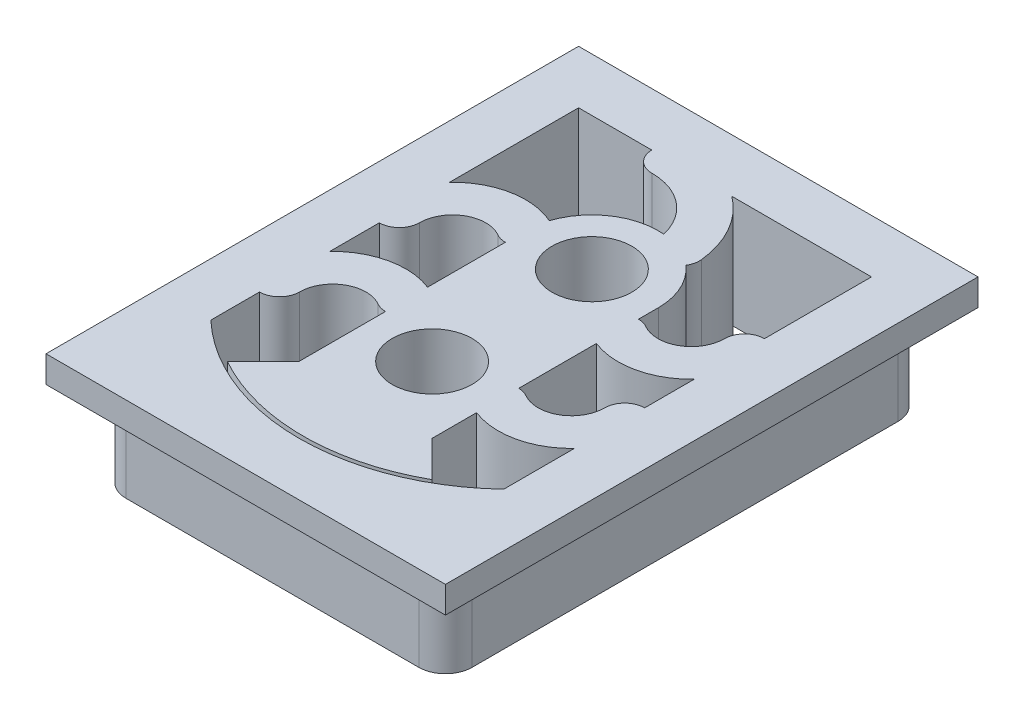
from build123d import *

# Parameters (mm, degrees)
SKETCH1_W           = 13
SKETCH1_H           = 18
BOSS_EXTRUDE1_DEPTH = 3.2
SKETCH2_W           = 15
SKETCH2_H           = 20
BOSS_EXTRUDE2_DEPTH = 1
SKETCH4_R           = 1.5
CUT_EXTRUDE2_DEPTH  = 14.18673576
FILLET1_R           = 1


with BuildPart() as part:
    # Sketch1 → Boss-Extrude1 (new body)
    with BuildSketch(Plane(origin=(0, 0, 0), x_dir=(1, 0, 0), z_dir=(0, 1, 0))):
        Rectangle(SKETCH1_W, SKETCH1_H)
    extrude(amount=BOSS_EXTRUDE1_DEPTH)

    # Sketch2 → Boss-Extrude2 (add)
    with BuildSketch(Plane(origin=(0, 3.2, 0), x_dir=(1, 0, 0), z_dir=(0, 1, 0))):
        Rectangle(SKETCH2_W, SKETCH2_H)
    extrude(amount=BOSS_EXTRUDE2_DEPTH)

    # Sketch4 → Cut-Extrude2 (cut, through all)
    with BuildSketch(Plane.XZ):
        with BuildLine():
            Line((-2.5, 5.5), (-3.844272635, 6.844272635))
            ThreePointArc((-3.844272635, 6.844272635), (0, 7.85), (3.844272635, 6.844272635))
            Line((3.844272635, 6.844272635), (2.5, 5.5))
            Line((2.5, 5.5), (2.5, 2.25))
            ThreePointArc((2.5, 2.25), (2.694114284, 2.22444437), (2.875, 2.149519053))
            ThreePointArc((2.875, 2.149519053), (4.125, 2.149519053), (4.75, 3.232050808))
            ThreePointArc((4.75, 3.232050808), (4.969669914, 3.762380893), (5.5, 3.982050808))
            Line((5.5, 3.982050808), (5.5, 5.809475019))
            ThreePointArc((5.5, 5.809475019), (0, 8), (-5.5, 5.809475019))
            Line((-5.5, 5.809475019), (-5.5, 3.155407801))
            ThreePointArc((-5.5, 3.155407801), (-4.103044833, 3.951014031), (-2.5, 3.829686884))
            Line((-2.5, 3.829686884), (-2.5, 5.5))
        make_face()
        with Locations(Location((0, 3, 0), (0, 0, 270))):
            Circle(SKETCH4_R)
        with BuildLine():
            Line((-2.5, -0.670313116), (-2.5, 2.25))
            ThreePointArc((-2.5, 2.25), (-2.694114284, 2.27555563), (-2.875, 2.350480947))
            ThreePointArc((-2.875, 2.350480947), (-4.125, 2.350480947), (-4.75, 1.267949192))
            ThreePointArc((-4.75, 1.267949192), (-4.969669914, 0.737619107), (-5.5, 0.517949192))
            Line((-5.5, 0.517949192), (-5.5, -1.344592199))
            ThreePointArc((-5.5, -1.344592199), (-4.103044833, -0.548985969), (-2.5, -0.670313116))
        make_face()
        with BuildLine():
            ThreePointArc((5.5, 1.344592199), (4.103044833, 0.548985969), (2.5, 0.670313116))
            Line((2.5, 0.670313116), (2.5, -2.25))
            ThreePointArc((2.5, -2.25), (2.694114284, -2.27555563), (2.875, -2.350480947))
            ThreePointArc((2.875, -2.350480947), (4.125, -2.350480947), (4.75, -1.267949192))
            ThreePointArc((4.75, -1.267949192), (4.969669914, -0.737619107), (5.5, -0.517949192))
            Line((5.5, -0.517949192), (5.5, 1.344592199))
        make_face()
        with Locations(Location((0, -3, 0), (0, 0, 270))):
            Circle(SKETCH4_R)
        with BuildLine():
            Line((-2.5, -3), (-2.5, -2.25))
            ThreePointArc((-2.5, -2.25), (-2.694114284, -2.22444437), (-2.875, -2.149519053))
            ThreePointArc((-2.875, -2.149519053), (-4.125, -2.149519053), (-4.75, -3.232050808))
            ThreePointArc((-4.75, -3.232050808), (-4.969669914, -3.762380893), (-5.5, -3.982050808))
            Line((-5.5, -3.982050808), (-5.5, -8))
            Line((-5.5, -8), (-0.25521468, -8))
            ThreePointArc((-0.25521468, -8), (-1.276630283, -6.840114098), (-1.746104794, -5.367626807))
            ThreePointArc((-1.746104794, -5.367626807), (-1.730239257, -5.120259699), (-1.634609263, -4.891574095))
            ThreePointArc((-1.634609263, -4.891574095), (-2.27338109, -4.040066547), (-2.5, -3))
        make_face()
        with BuildLine():
            ThreePointArc((5.5, -3.155407801), (4.037255458, -3.964958012), (2.375948891, -3.777731873))
            ThreePointArc((2.375948891, -3.777731873), (1.381615815, -5.083539714), (-0.208211888, -5.491314474))
            ThreePointArc((-0.208211888, -5.491314474), (0.58851368, -6.756605145), (2, -7.25))
            ThreePointArc((2, -7.25), (2.530330086, -7.469669914), (2.75, -8))
            Line((2.75, -8), (5.5, -8))
            Line((5.5, -8), (5.5, -3.155407801))
        make_face()
    extrude(amount=-CUT_EXTRUDE2_DEPTH, mode=Mode.SUBTRACT)

    # Fillet1
    fillet1_edges = [part.edges().sort_by_distance(p)[0] for p in [
        (6.5, 1.6, 9),
        (-6.5, 1.6, 9),
        (-6.5, 1.6, -9),
        (6.5, 1.6, -9),
    ]]
    fillet(fillet1_edges, radius=FILLET1_R)


with BuildPart() as body_2:
    # Mirror2: mirrored copy
    add(part.part.mirror(Plane(origin=(7.5, 4.2, 10), x_dir=(0, 0, 1), z_dir=(-1, 0, 0))))


solid = body_2.part
